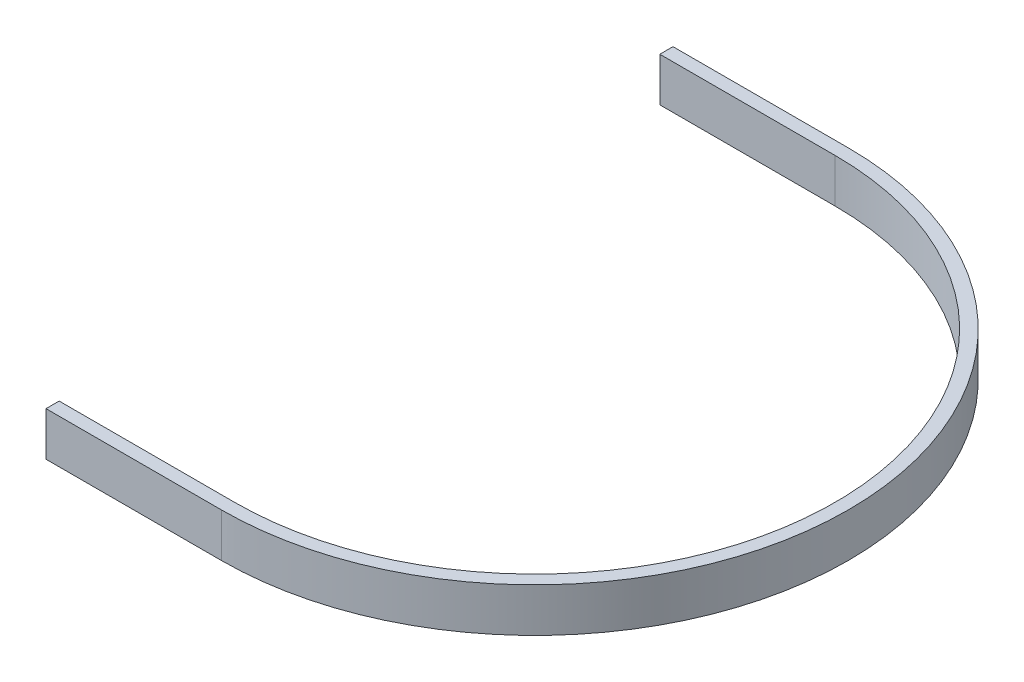
from build123d import *

# Parameters (mm, degrees)
BOSS_EXTRU_1_DEPTH = 10
ESQUISSE3_W        = 3
ESQUISSE3_H        = 10
BOSS_EXTRU_2_DEPTH = 40


with BuildPart() as part:
    # Esquisse2 → Boss.-Extru.1 (new body)
    with BuildSketch(Plane(origin=(0, 0, 0), x_dir=(1, 0, 0), z_dir=(0, 1, 0))):
        with BuildLine():
            Line((0, 71.5), (0, 68.5))
            ThreePointArc((0, 68.5), (48.436814511, 48.436814511), (68.5, 0))
            ThreePointArc((68.5, 0), (48.436814511, -48.436814511), (0, -68.5))
            Line((0, -68.5), (0, -71.5))
            ThreePointArc((0, -71.5), (50.558134855, -50.558134855), (71.5, 0))
            ThreePointArc((71.5, 0), (50.558134855, 50.558134855), (0, 71.5))
        make_face()
    extrude(amount=BOSS_EXTRU_1_DEPTH)

    # Esquisse3 → Boss.-Extru.2 (add)
    with BuildSketch(Plane.ZY):
        with Locations((-70, 5)):
            Rectangle(ESQUISSE3_W, ESQUISSE3_H)
        with Locations((70, 5)):
            Rectangle(ESQUISSE3_W, ESQUISSE3_H)
    extrude(amount=BOSS_EXTRU_2_DEPTH)


solid = part.part
